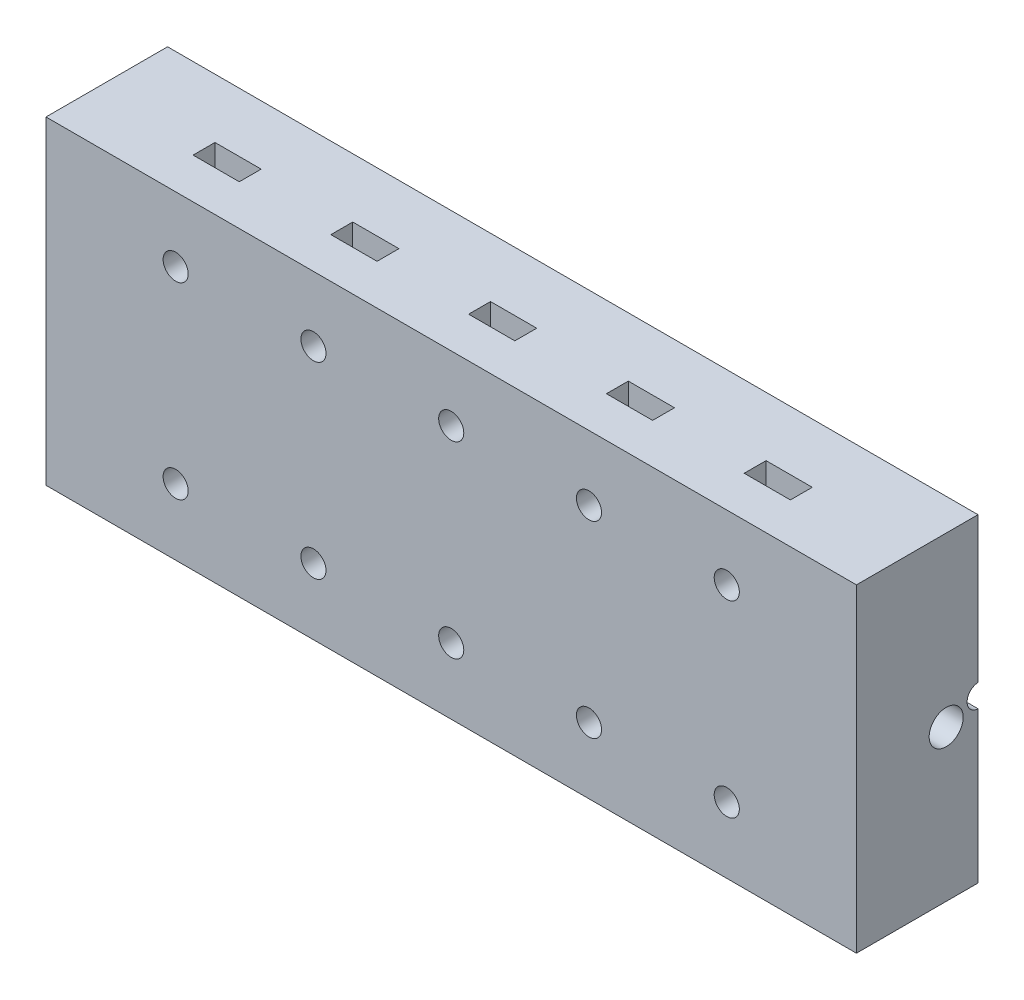
from build123d import *

# Parameters (mm, degrees)
SKIZZE2_W                            = 100
SKIZZE2_H                            = 39.364160046
AUFSATZ_LINEAR_AUSTRAGEN1_DEPTH      = 30
SCHNITT_LINEAR_AUSTRAGEN1_DEPTH      = 40
SCHNITT_LINEAR_AUSTRAGEN1_DEPTH_BACK = 40
SKIZZE10_R                           = 5
SKIZZE17_R                           = 1.4
SCHNITT_LINEAR_AUSTRAGEN2_DEPTH      = 103.710939516
SKIZZE24_R                           = 1.55
SCHNITT_LINEAR_AUSTRAGEN4_DEPTH      = 112.577493681
SKIZZE37_R                           = 0.736865544
SCHNITT_LINEAR_AUSTRAGEN9_DEPTH      = 112.577493681
SKIZZE40_R                           = 2.1
SCHNITT_LINEAR_AUSTRAGEN10_DEPTH     = 6
SKIZZE42_R                           = 0.75
SCHNITT_LINEAR_AUSTRAGEN12_DEPTH     = 10
VERRUNDUNG1_R                        = 1
SKIZZE46_R                           = 2.85
SCHNITT_LINEAR_AUSTRAGEN15_DEPTH     = 10
SCHNITT_LINEAR_START                 = -5
SCHNITT_LINEAR_AUSTRAGEN25_DEPTH     = 2.7
LINEARES_MUSTER1_COUNT               = 5
LINEARES_MUSTER1_PITCH               = 17
SPIEGELN2_COPY_1_SKETCH_R            = 2.85
SPIEGELN2_COPY_1_DEPTH               = 10
SPIEGELN2_COPY_2_SKETCH_R            = 2.85
SPIEGELN2_COPY_2_DEPTH               = 10
SPIEGELN2_COPY_3_SKETCH_R            = 2.85
SPIEGELN2_COPY_3_DEPTH               = 10
SPIEGELN2_COPY_4_SKETCH_R            = 2.85
SPIEGELN2_COPY_4_DEPTH               = 10
SPIEGELN2_START                      = -5
SPIEGELN2_COPY_5_DEPTH               = 2.7
SPIEGELN2_COPY_6_DEPTH               = 2.7
SPIEGELN2_COPY_7_DEPTH               = 2.7
SPIEGELN2_COPY_8_DEPTH               = 2.7
SKIZZE45_W                           = 15
SKIZZE45_H                           = 39.364160046
SCHNITT_LINEAR_AUSTRAGEN14_DEPTH     = 100


with BuildPart() as part:
    # Skizze2 → Aufsatz-Linear austragen1 (new body)
    with BuildSketch(Plane.XY):
        with Locations((50, 19.682080023)):
            Rectangle(SKIZZE2_W, SKIZZE2_H)
    extrude(amount=AUFSATZ_LINEAR_AUSTRAGEN1_DEPTH)

    # Skizze10 → Schnitt-Linear austragen1 (cut, two sides: drawn at the far end of the back side and taken through both)
    with BuildSketch(Plane.ZY.offset(-50).offset(-SCHNITT_LINEAR_AUSTRAGEN1_DEPTH_BACK)):
        with Locations((14.945770016, 20.027045739)):
            Circle(SKIZZE10_R)
    extrude(amount=SCHNITT_LINEAR_AUSTRAGEN1_DEPTH + SCHNITT_LINEAR_AUSTRAGEN1_DEPTH_BACK, mode=Mode.SUBTRACT)

    # Skizze17 → Schnitt-Linear austragen2 (cut, through all)
    with BuildSketch(Plane.ZY.offset(-90)):
        with Locations((14.945770016, 20.027045739)):
            Circle(SKIZZE17_R)
    schnitt_linear_austragen2 = extrude(amount=-SCHNITT_LINEAR_AUSTRAGEN2_DEPTH, mode=Mode.SUBTRACT)

    # Spiegeln1: Schnitt-Linear austragen2 across plane
    add(schnitt_linear_austragen2.mirror(Plane.ZY.offset(-50)), mode=Mode.SUBTRACT)

    # Skizze24 → Schnitt-Linear austragen4 (cut, through all)
    with BuildSketch(Plane.XY.offset(30)):
        with Locations((16, 31.364160046)):
            Circle(SKIZZE24_R)
        with Locations((33, 31.364160046)):
            Circle(SKIZZE24_R)
        with Locations((50, 31.364160046)):
            Circle(SKIZZE24_R)
        with Locations((67, 31.364160046)):
            Circle(SKIZZE24_R)
        with Locations((84, 31.364160046)):
            Circle(SKIZZE24_R)
    schnitt_linear_austragen4 = extrude(amount=-SCHNITT_LINEAR_AUSTRAGEN4_DEPTH, mode=Mode.SUBTRACT)

    # Skizze37 → Schnitt-Linear austragen9 (cut, through all)
    with BuildSketch(Plane(origin=(100, 0, 0), x_dir=(0, 0, -1), z_dir=(1, 0, 0))):
        with Locations((-18.924590299, 18.633559666)):
            Circle(SKIZZE37_R)
    extrude(amount=-SCHNITT_LINEAR_AUSTRAGEN9_DEPTH, mode=Mode.SUBTRACT)

    # Skizze40 → Schnitt-Linear austragen10 (cut)
    with BuildSketch(Plane(origin=(100, 0, 0), x_dir=(0, 0, -1), z_dir=(1, 0, 0))):
        with Locations((-18.924590299, 18.633559666)):
            Circle(SKIZZE40_R)
    extrude(amount=-SCHNITT_LINEAR_AUSTRAGEN10_DEPTH, mode=Mode.SUBTRACT)

    # Skizze42 → Schnitt-Linear austragen12 (cut)
    with BuildSketch(Plane.ZY):
        with Locations((10.86415918, 18.842582577)):
            Circle(SKIZZE42_R)
    extrude(amount=-SCHNITT_LINEAR_AUSTRAGEN12_DEPTH, mode=Mode.SUBTRACT)

    # Verrundung1
    verrundung1_edges = [part.edges().sort_by_distance(p)[0] for p in [
        (94, 18.633559666, 19.661455843),
    ]]
    fillet(verrundung1_edges, radius=VERRUNDUNG1_R)

    # Skizze46 → Schnitt-Linear austragen15 (cut)
    with BuildSketch(Plane(origin=(0, 0, 0), x_dir=(-1, 0, 0), z_dir=(0, 0, -1))):
        with Locations((-84, 31.364160046)):
            Circle(SKIZZE46_R)
    schnitt_linear_austragen15 = extrude(amount=-SCHNITT_LINEAR_AUSTRAGEN15_DEPTH, mode=Mode.SUBTRACT)

    # Skizze50 → Schnitt-Linear austragen25 (cut)
    with BuildSketch(Plane.XY.offset(30).offset(SCHNITT_LINEAR_START)):
        Polygon((81.15, 33.009608314), (81.15, 39.364160046), (86.85, 39.364160046), (86.85, 33.009608314), (86.85, 29.718711779), (84, 28.073263512), (81.15, 29.718711779), align=None)
    schnitt_linear_austragen25 = extrude(amount=-SCHNITT_LINEAR_AUSTRAGEN25_DEPTH, mode=Mode.SUBTRACT)

    # Lineares Muster1: Schnitt-Linear austragen15, Schnitt-Linear austragen25 ×5
    with Locations(*[(-i * LINEARES_MUSTER1_PITCH, 0, 0) for i in range(1, LINEARES_MUSTER1_COUNT)]):
        add(schnitt_linear_austragen15, mode=Mode.SUBTRACT)
        add(schnitt_linear_austragen25, mode=Mode.SUBTRACT)

    # Spiegeln2: Schnitt-Linear austragen15, Schnitt-Linear austragen25 across plane
    add(schnitt_linear_austragen15.mirror(Plane.ZX.offset(19.764160046)), mode=Mode.SUBTRACT)
    add(schnitt_linear_austragen25.mirror(Plane.ZX.offset(19.764160046)), mode=Mode.SUBTRACT)

    # Spiegeln2 copy 1 sketch → Spiegeln2 copy 1 (cut)
    with BuildSketch(Plane(origin=(-17, 39.528320093, 0), x_dir=(-1, 0, 0), z_dir=(0, 0, -1))):
        with Locations((-84, -31.364160046)):
            Circle(SPIEGELN2_COPY_1_SKETCH_R)
    extrude(amount=-SPIEGELN2_COPY_1_DEPTH, mode=Mode.SUBTRACT)

    # Spiegeln2 copy 2 sketch → Spiegeln2 copy 2 (cut)
    with BuildSketch(Plane(origin=(-34, 39.528320093, 0), x_dir=(-1, 0, 0), z_dir=(0, 0, -1))):
        with Locations((-84, -31.364160046)):
            Circle(SPIEGELN2_COPY_2_SKETCH_R)
    extrude(amount=-SPIEGELN2_COPY_2_DEPTH, mode=Mode.SUBTRACT)

    # Spiegeln2 copy 3 sketch → Spiegeln2 copy 3 (cut)
    with BuildSketch(Plane(origin=(-51, 39.528320093, 0), x_dir=(-1, 0, 0), z_dir=(0, 0, -1))):
        with Locations((-84, -31.364160046)):
            Circle(SPIEGELN2_COPY_3_SKETCH_R)
    extrude(amount=-SPIEGELN2_COPY_3_DEPTH, mode=Mode.SUBTRACT)

    # Spiegeln2 copy 4 sketch → Spiegeln2 copy 4 (cut)
    with BuildSketch(Plane(origin=(-68, 39.528320093, 0), x_dir=(-1, 0, 0), z_dir=(0, 0, -1))):
        with Locations((-84, -31.364160046)):
            Circle(SPIEGELN2_COPY_4_SKETCH_R)
    extrude(amount=-SPIEGELN2_COPY_4_DEPTH, mode=Mode.SUBTRACT)

    # Spiegeln2 copy 5 sketch → Spiegeln2 copy 5 (cut)
    with BuildSketch(Plane(origin=(-17, 39.528320093, 30), x_dir=(1, 0, 0), z_dir=(0, 0, 1)).offset(SPIEGELN2_START)):
        Polygon((81.15, -33.009608314), (81.15, -39.364160046), (86.85, -39.364160046), (86.85, -33.009608314), (86.85, -29.718711779), (84, -28.073263512), (81.15, -29.718711779), align=None)
    extrude(amount=-SPIEGELN2_COPY_5_DEPTH, mode=Mode.SUBTRACT)

    # Spiegeln2 copy 6 sketch → Spiegeln2 copy 6 (cut)
    with BuildSketch(Plane(origin=(-34, 39.528320093, 30), x_dir=(1, 0, 0), z_dir=(0, 0, 1)).offset(SPIEGELN2_START)):
        Polygon((81.15, -33.009608314), (81.15, -39.364160046), (86.85, -39.364160046), (86.85, -33.009608314), (86.85, -29.718711779), (84, -28.073263512), (81.15, -29.718711779), align=None)
    extrude(amount=-SPIEGELN2_COPY_6_DEPTH, mode=Mode.SUBTRACT)

    # Spiegeln2 copy 7 sketch → Spiegeln2 copy 7 (cut)
    with BuildSketch(Plane(origin=(-51, 39.528320093, 30), x_dir=(1, 0, 0), z_dir=(0, 0, 1)).offset(SPIEGELN2_START)):
        Polygon((81.15, -33.009608314), (81.15, -39.364160046), (86.85, -39.364160046), (86.85, -33.009608314), (86.85, -29.718711779), (84, -28.073263512), (81.15, -29.718711779), align=None)
    extrude(amount=-SPIEGELN2_COPY_7_DEPTH, mode=Mode.SUBTRACT)

    # Spiegeln2 copy 8 sketch → Spiegeln2 copy 8 (cut)
    with BuildSketch(Plane(origin=(-68, 39.528320093, 30), x_dir=(1, 0, 0), z_dir=(0, 0, 1)).offset(SPIEGELN2_START)):
        Polygon((81.15, -33.009608314), (81.15, -39.364160046), (86.85, -39.364160046), (86.85, -33.009608314), (86.85, -29.718711779), (84, -28.073263512), (81.15, -29.718711779), align=None)
    extrude(amount=-SPIEGELN2_COPY_8_DEPTH, mode=Mode.SUBTRACT)

    # Spiegeln3: Schnitt-Linear austragen4 across plane
    add(schnitt_linear_austragen4.mirror(Plane.ZX.offset(19.764160046)), mode=Mode.SUBTRACT)

    # Skizze45 → Schnitt-Linear austragen14 (cut)
    with BuildSketch(Plane(origin=(100, 0, 0), x_dir=(0, 0, -1), z_dir=(1, 0, 0))):
        with Locations((-7.5, 19.682080023)):
            Rectangle(SKIZZE45_W, SKIZZE45_H)
    extrude(amount=-SCHNITT_LINEAR_AUSTRAGEN14_DEPTH, mode=Mode.SUBTRACT)


solid = part.part
